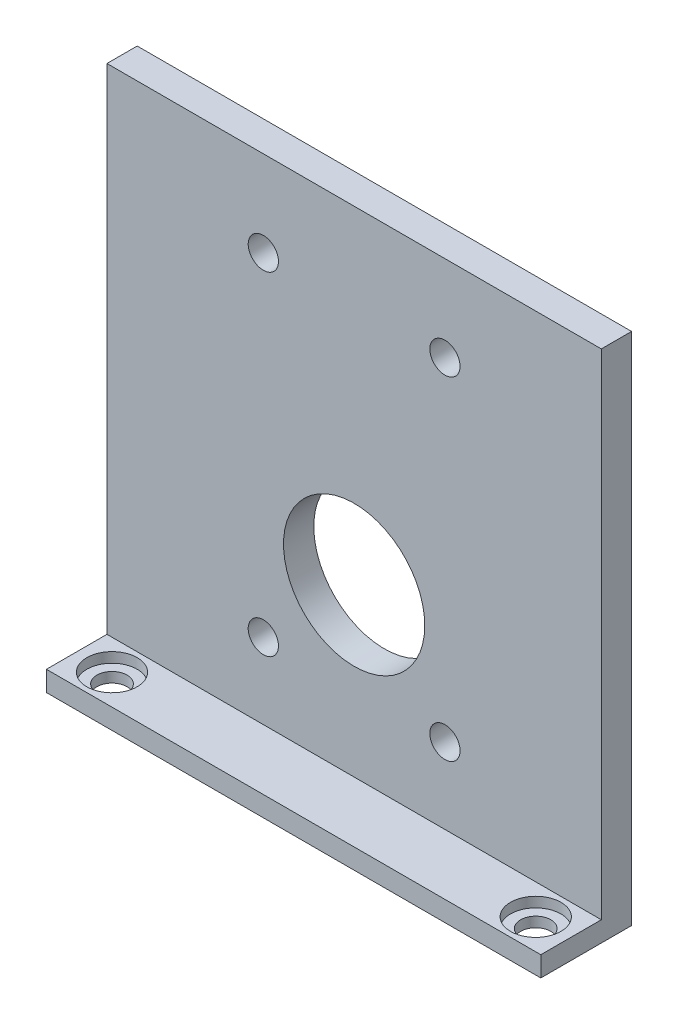
from build123d import *

# Parameters (mm, degrees)
SKETCH1_W           = 49
SKETCH1_H           = 9
BOSS_EXTRUDE1_DEPTH = 2
SKETCH2_W           = 49
SKETCH2_H           = 3
BOSS_EXTRUDE2_DEPTH = 49
SKETCH3_R           = 1.5
SKETCH3_R_2         = 7
CUT_EXTRUDE1_DEPTH  = 3
SKETCH4_R           = 2.5
CUT_EXTRUDE2_DEPTH  = 1
SKETCH5_R           = 1.5
CUT_EXTRUDE3_DEPTH  = 2
SKETCH6_R           = 1.5
CUT_EXTRUDE4_DEPTH  = 2


with BuildPart() as part:
    # Sketch1 → Boss-Extrude1 (new body)
    with BuildSketch(Plane(origin=(0, 0, 0), x_dir=(1, 0, 0), z_dir=(0, 1, 0))):
        Rectangle(SKETCH1_W, SKETCH1_H)
    extrude(amount=BOSS_EXTRUDE1_DEPTH)

    # Sketch2 → Boss-Extrude2 (add)
    with BuildSketch(Plane(origin=(0, 2, 0), x_dir=(1, 0, 0), z_dir=(0, 1, 0))):
        with Locations((0, 3)):
            Rectangle(SKETCH2_W, SKETCH2_H)
    extrude(amount=BOSS_EXTRUDE2_DEPTH)

    # Sketch3 → Cut-Extrude1 (cut)
    with BuildSketch(Plane.XY.offset(-1.5)):
        with Locations((-9, 9.5)):
            Circle(SKETCH3_R)
        with Locations((9, 9.5)):
            Circle(SKETCH3_R)
        with Locations((-9, 42.5)):
            Circle(SKETCH3_R)
        with Locations((9, 42.5)):
            Circle(SKETCH3_R)
        with Locations((0, 18.5)):
            Circle(SKETCH3_R_2)
    extrude(amount=-CUT_EXTRUDE1_DEPTH, mode=Mode.SUBTRACT)

    # Sketch4 → Cut-Extrude2 (cut)
    with BuildSketch(Plane(origin=(0, 2, 0), x_dir=(1, 0, 0), z_dir=(0, 1, 0))):
        with Locations(Location((-21, -1.5, 0), (0, 0, 270))):
            Circle(SKETCH4_R)
        with Locations(Location((21, -1.5, 0), (0, 0, 270))):
            Circle(SKETCH4_R)
    extrude(amount=-CUT_EXTRUDE2_DEPTH, mode=Mode.SUBTRACT)

    # Sketch5 → Cut-Extrude3 (cut)
    with BuildSketch(Plane(origin=(0, 1, 0), x_dir=(1, 0, 0), z_dir=(0, 1, 0))):
        with Locations(Location((-21, -1.5, 0), (0, 0, 270))):
            Circle(SKETCH5_R)
    extrude(amount=-CUT_EXTRUDE3_DEPTH, mode=Mode.SUBTRACT)

    # Sketch6 → Cut-Extrude4 (cut)
    with BuildSketch(Plane(origin=(0, 1, 0), x_dir=(1, 0, 0), z_dir=(0, 1, 0))):
        with Locations(Location((21, -1.5, 0), (0, 0, 270))):
            Circle(SKETCH6_R)
    extrude(amount=-CUT_EXTRUDE4_DEPTH, mode=Mode.SUBTRACT)


solid = part.part
